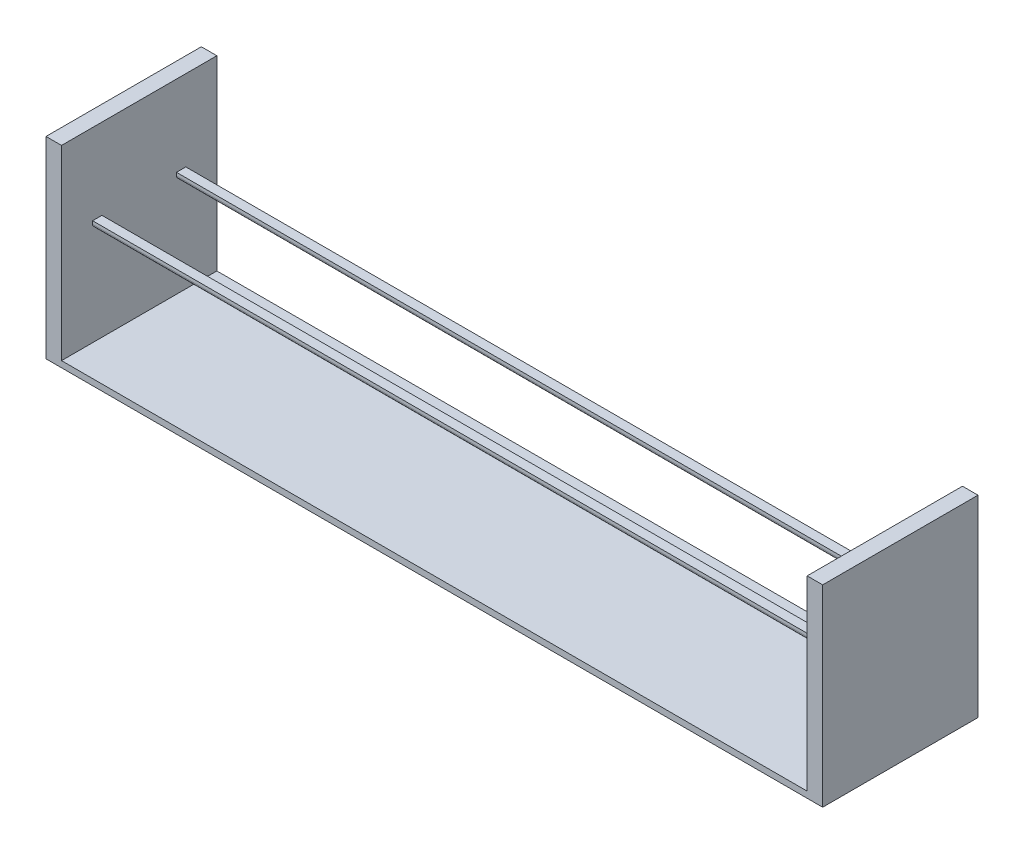
from build123d import *

# Parameters (mm, degrees)
SKETCH2_W           = 1250
SKETCH2_H           = 250
BOSS_EXTRUDE1_DEPTH = 10
SKETCH3_W           = 25
SKETCH3_H           = 250
BOSS_EXTRUDE2_DEPTH = 300
SKETCH4_W           = 15
SKETCH4_H           = 10
BOSS_EXTRUDE3_DEPTH = 1200
FILLET1_R           = 5
FILLET3_R           = 5


with BuildPart() as part:
    # Sketch2 → Boss-Extrude1 (new body)
    with BuildSketch(Plane(origin=(0, 0, 0), x_dir=(1, 0, 0), z_dir=(0, 1, 0))):
        with Locations((546.563322885, -102.85317352)):
            Rectangle(SKETCH2_W, SKETCH2_H)
    extrude(amount=BOSS_EXTRUDE1_DEPTH)

    # Sketch3 → Boss-Extrude2 (add)
    with BuildSketch(Plane(origin=(0, 10, 0), x_dir=(1, 0, 0), z_dir=(0, 1, 0))):
        with Locations((-65.936677115, -102.85317352)):
            Rectangle(SKETCH3_W, SKETCH3_H)
        with Locations((1159.063322885, -102.85317352)):
            Rectangle(SKETCH3_W, SKETCH3_H)
    extrude(amount=BOSS_EXTRUDE2_DEPTH)

    # Sketch4 → Boss-Extrude3 (add)
    with BuildSketch(Plane(origin=(-53.436677115, 0, 0), x_dir=(0, 0, -1), z_dir=(1, 0, 0))):
        with Locations((-170.35317352, 175)):
            Rectangle(SKETCH4_W, SKETCH4_H)
        with Locations((-35.35317352, 175)):
            Rectangle(SKETCH4_W, SKETCH4_H)
    extrude(amount=BOSS_EXTRUDE3_DEPTH)

    # Fillet1
    fillet1_edges = [part.edges().sort_by_distance(p)[0] for p in [
        (546.563322885, 170, 177.85317352),
        (546.563322885, 170, 162.85317352),
    ]]
    fillet(fillet1_edges, radius=FILLET1_R)

    # Fillet3
    fillet3_edges = [part.edges().sort_by_distance(p)[0] for p in [
        (546.563322885, 170, 42.85317352),
        (546.563322885, 170, 27.85317352),
    ]]
    fillet(fillet3_edges, radius=FILLET3_R)


solid = part.part
